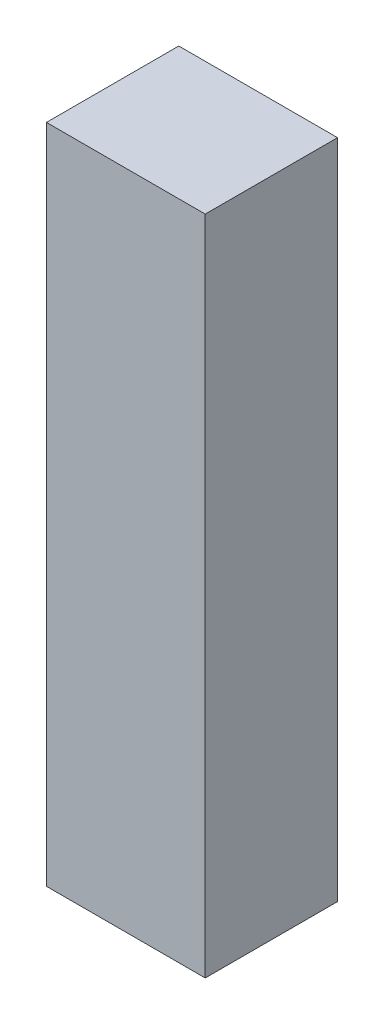
from build123d import *

# Parameters (mm, degrees)
SKETCH2_W           = 24
SKETCH2_H           = 100
BOSS_EXTRUDE1_DEPTH = 20


with BuildPart() as part:
    # Sketch2 → Boss-Extrude1 (new body)
    with BuildSketch(Plane.XY):
        Rectangle(SKETCH2_W, SKETCH2_H)
    extrude(amount=BOSS_EXTRUDE1_DEPTH)


solid = part.part
